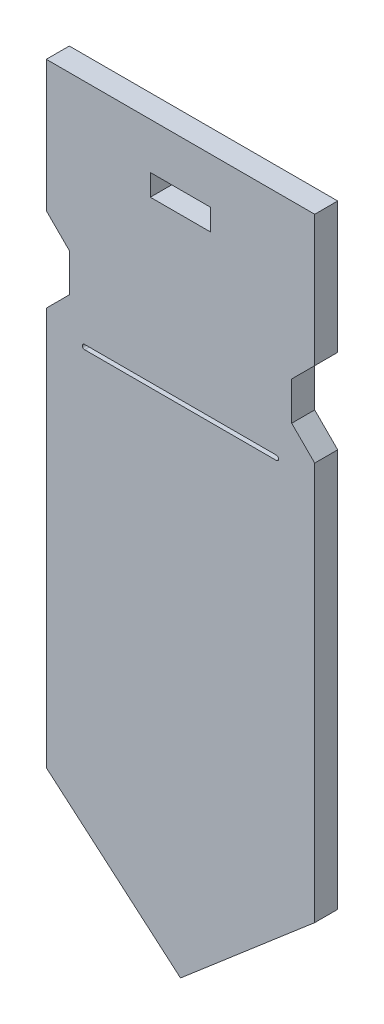
from build123d import *

# Parameters (mm, degrees)
ESBO_O1_W                = 7.874
ESBO_O1_H                = 2.794
RESSALTO_EXTRUS_O1_DEPTH = 3


with BuildPart() as part:
    # Esboço1 → Ressalto-extrusão1 (new body)
    with BuildSketch(Plane.XY):
        Polygon((17.5, -95), (35, -80), (35, -28.1), (32, -25.1), (32, -20.1), (35, -17.1), (35, 0), (0, 0), (0, -17.1), (3, -20.1), (3, -25.1), (0, -28.1), (0, -80), align=None)
        with BuildLine():
            ThreePointArc((5, -30.3), (4.7, -30), (5, -29.7))
            Line((5, -29.7), (30, -29.7))
            ThreePointArc((30, -29.7), (30.3, -30), (30, -30.3))
            Line((30, -30.3), (5, -30.3))
        make_face(mode=Mode.SUBTRACT)
        with Locations((17.5, -7.397)):
            Rectangle(ESBO_O1_W, ESBO_O1_H, mode=Mode.SUBTRACT)
    extrude(amount=RESSALTO_EXTRUS_O1_DEPTH)


solid = part.part
